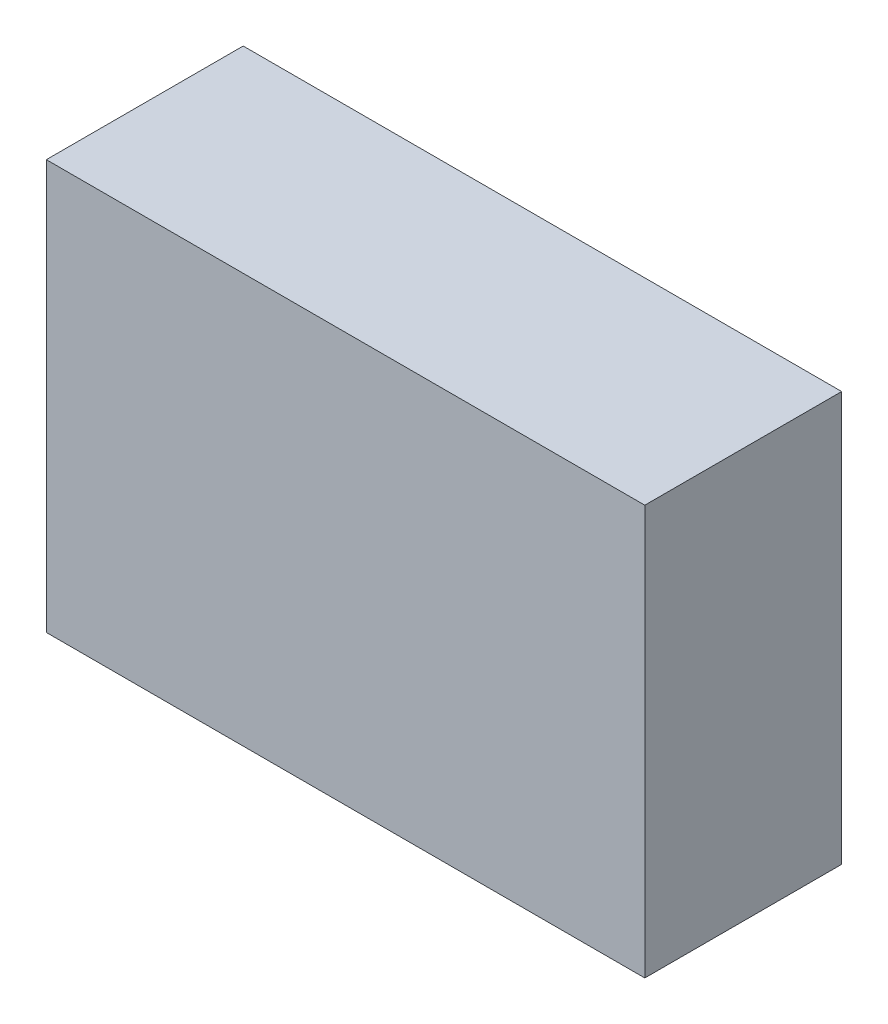
from build123d import *

# Parameters (mm, degrees)
SKETCH_1_W                         = 76
SKETCH_1_H                         = 52
FUSED_DISTRIBUTION_ENCLOSURE_DEPTH = 25


with BuildPart() as part:
    # 草图1 → Fused_distribution_enclosure (new body)
    with BuildSketch(Plane.XY):
        with Locations((38, 26)):
            Rectangle(SKETCH_1_W, SKETCH_1_H)
    extrude(amount=FUSED_DISTRIBUTION_ENCLOSURE_DEPTH)


solid = part.part
